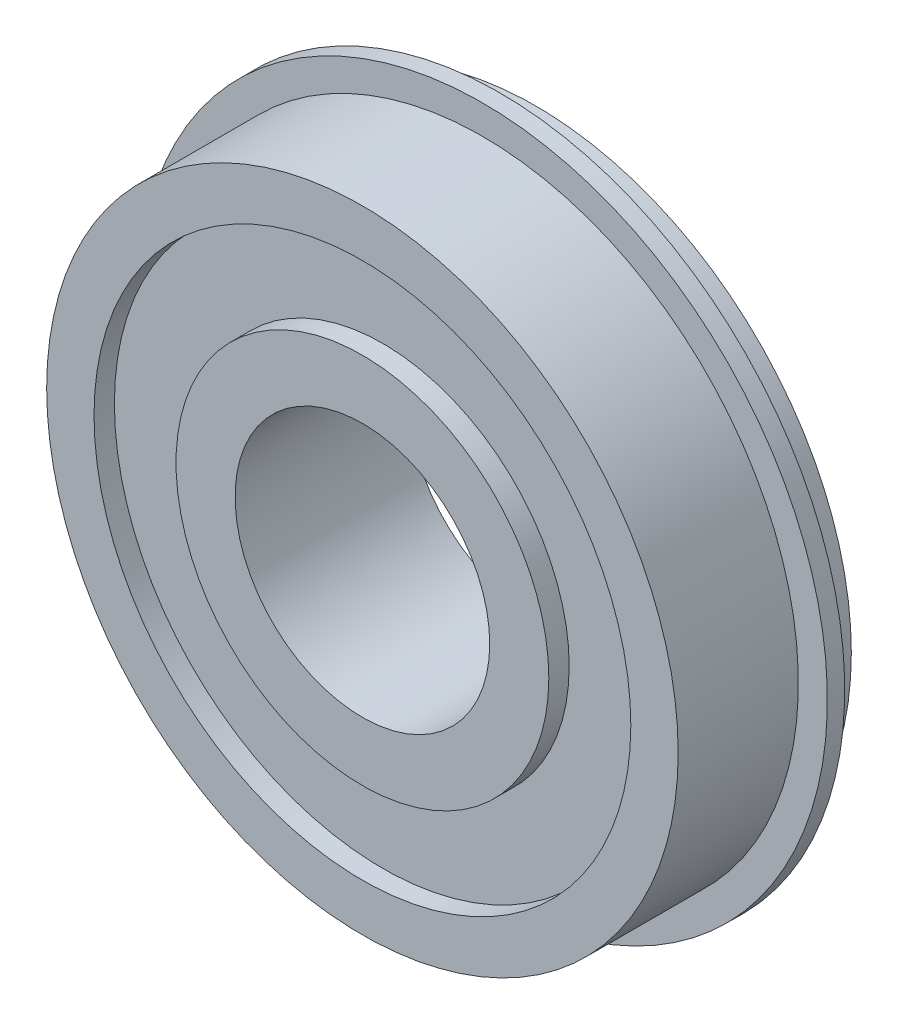
from build123d import *

# Parameters (mm, degrees)
SKETCH1_R           = 31
SKETCH1_R_2         = 12.5
BOSS_EXTRUDE1_DEPTH = 8.5
SKETCH3_R           = 26.35
SKETCH3_R_2         = 18.3
CUT_EXTRUDE1_DEPTH  = 2
BOSS_EXTRUDE2_START = -1.7
SKETCH4_R           = 33.85
SKETCH4_R_2         = 31
BOSS_EXTRUDE2_DEPTH = 1.7


with BuildPart() as part:
    # Sketch1 → Boss-Extrude1 (new, symmetric)
    with BuildSketch(Plane.XY):
        Circle(SKETCH1_R)
        Circle(SKETCH1_R_2, mode=Mode.SUBTRACT)
    extrude(amount=BOSS_EXTRUDE1_DEPTH, both=True)

    # Sketch3 → Cut-Extrude1 (cut)
    with BuildSketch(Plane.XY.offset(8.5)):
        Circle(SKETCH3_R)
        Circle(SKETCH3_R_2, mode=Mode.SUBTRACT)
    cut_extrude1 = extrude(amount=-CUT_EXTRUDE1_DEPTH, mode=Mode.SUBTRACT)

    # Mirror1: Cut-Extrude1 across plane
    add(cut_extrude1.mirror(Plane.XY), mode=Mode.SUBTRACT)

    # Sketch4 → Boss-Extrude2 (add)
    with BuildSketch(Plane(origin=(0, 0, -5), x_dir=(-1, 0, 0), z_dir=(0, 0, -1)).offset(BOSS_EXTRUDE2_START)):
        Circle(SKETCH4_R)
        Circle(SKETCH4_R_2, mode=Mode.SUBTRACT)
    extrude(amount=BOSS_EXTRUDE2_DEPTH)


solid = part.part
